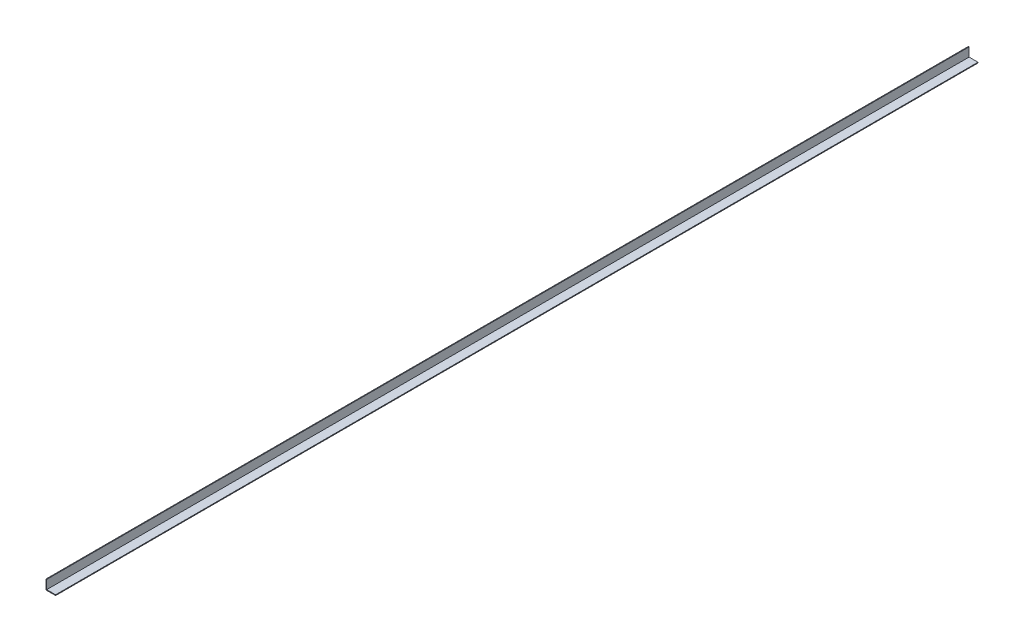
from build123d import *

# Parameters (mm, degrees)
SALIENTE_EXTRUIR1_DEPTH = 6100


with BuildPart() as part:
    # Croquis1 → Saliente-Extruir1 (new body)
    with BuildSketch(Plane.XY):
        Polygon((0, 63.5), (0, 0), (63.5, 0), (63.5, 4.76), (4.76, 4.76), (4.76, 63.5), align=None)
    extrude(amount=-SALIENTE_EXTRUIR1_DEPTH)


solid = part.part
